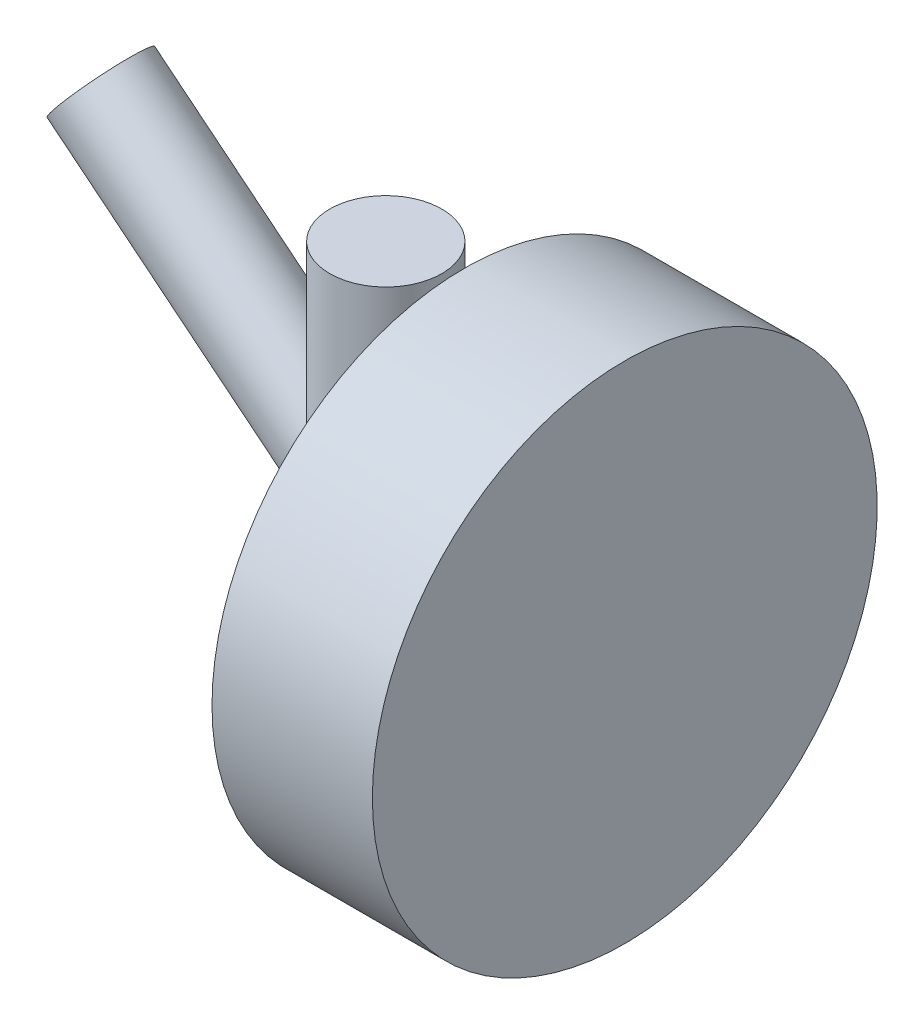
from build123d import *

# Parameters (mm, degrees)
SKETCH1_R           = 314.7949
BOSS_EXTRUDE1_DEPTH = 99.9998
BOSS_EXTRUDE2_START = 152.4
SKETCH2_R           = 69.85
BOSS_EXTRUDE2_DEPTH = 457.2
SKETCH4_R           = 56.896


with BuildPart() as part:
    # Sketch1 → Boss-Extrude1 (new, symmetric)
    with BuildSketch(Plane(origin=(0, 0, 0), x_dir=(0, 0, -1), z_dir=(1, 0, 0))):
        with Locations(Location((0, 0, 0), (0, 0, 180))):
            Circle(SKETCH1_R)
    extrude(amount=BOSS_EXTRUDE1_DEPTH, both=True)


with BuildPart() as body_2:
    # Sketch2 → Boss-Extrude2 (new body)
    with BuildSketch(Plane(origin=(0, -314.7949, 0), x_dir=(1, 0, 0), z_dir=(0, 1, 0)).offset(BOSS_EXTRUDE2_START)):
        with Locations(Location((-198.0692, 0, 0), (0, 0, 270))):
            Circle(SKETCH2_R)
    extrude(amount=BOSS_EXTRUDE2_DEPTH)

    # Sweep1: sweep along a path in Sketch3
    with BuildLine(Plane.XY) as sweep1_path:
        Line((-198.0692, 1.6383), (-553.380333578, 289.363582788))
    # Sketch4 → Sweep1 (sweep)
    with BuildSketch(Plane(origin=(-553.380333578, 289.363582788, 0), x_dir=(0, 0, 1), z_dir=(-0.7771459614569677, 0.6293203910498415, 0))):
        Circle(SKETCH4_R)
    sweep(path=sweep1_path.line)


solid = Compound([part.part, body_2.part])
